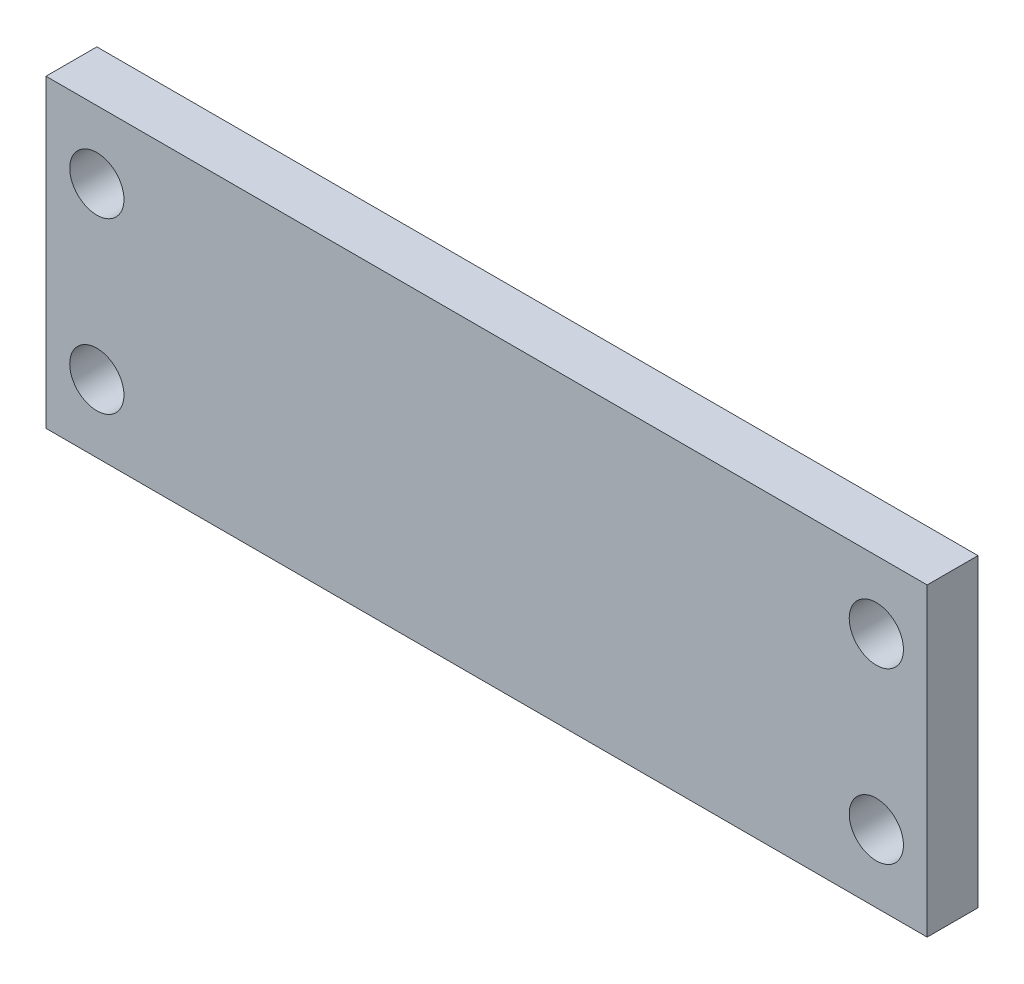
from build123d import *

# Parameters (mm, degrees)
SKETCH2_W           = 52
SKETCH2_H           = 18
SKETCH2_R           = 1.6
BOSS_EXTRUDE1_DEPTH = 3


with BuildPart() as part:
    # Sketch2 → Boss-Extrude1 (new body)
    with BuildSketch(Plane.XY):
        Rectangle(SKETCH2_W, SKETCH2_H)
        with Locations(Location((-23, -5, 0), (0, 0, 180))):
            Circle(SKETCH2_R, mode=Mode.SUBTRACT)
        with Locations((-23, 5)):
            Circle(SKETCH2_R, mode=Mode.SUBTRACT)
        with Locations((23, -5)):
            Circle(SKETCH2_R, mode=Mode.SUBTRACT)
        with Locations(Location((23, 5, 0), (0, 0, 180))):
            Circle(SKETCH2_R, mode=Mode.SUBTRACT)
    extrude(amount=BOSS_EXTRUDE1_DEPTH)


solid = part.part
